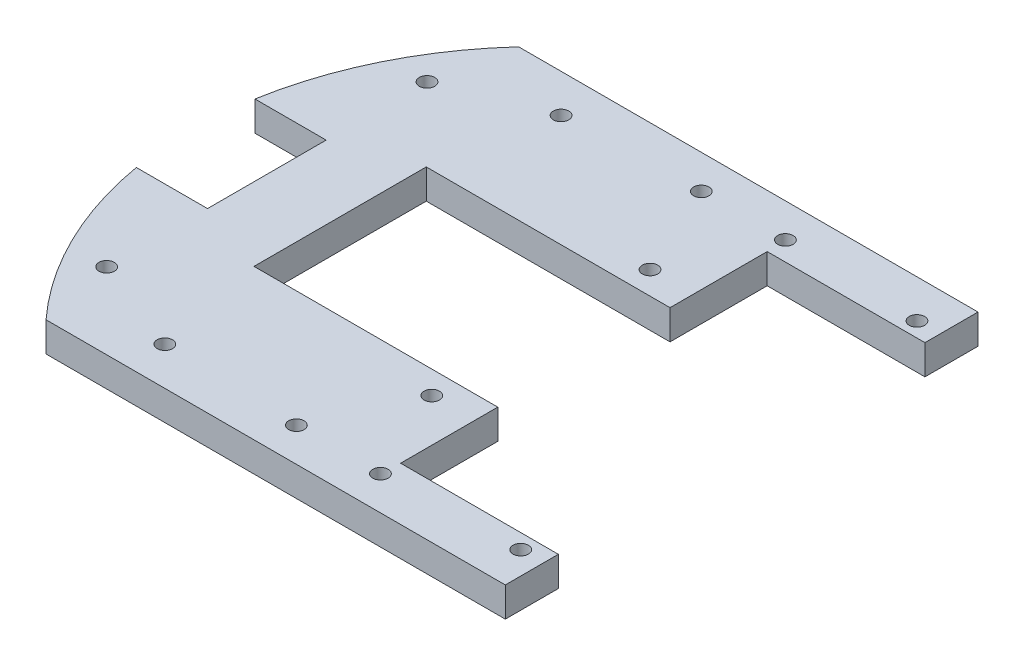
from build123d import *

# Parameters (mm, degrees)
SKETCH1_R           = 1.651
BOSS_EXTRUDE1_DEPTH = 6.35


with BuildPart() as part:
    # Sketch1 → Boss-Extrude1 (new body)
    with BuildSketch(Plane(origin=(0, 0, 0), x_dir=(1, 0, 0), z_dir=(0, 1, 0))):
        with BuildLine():
            Line((33.776652136, 7.168881649), (0, 7.168881649))
            Line((0, 7.168881649), (0, 44.052727236))
            Line((0, 44.052727236), (33.776652136, 44.052727236))
            Line((33.776652136, 44.052727236), (52.191652136, 44.052727236))
            Line((52.191652136, 44.052727236), (52.191652136, 64.853804442))
            Line((52.191652136, 64.853804442), (85.968304273, 64.853804442))
            Line((85.968304273, 64.853804442), (85.968304273, 76.214266248))
            Line((85.968304273, 76.214266248), (0, 76.214266248))
            Line((0, 76.214266248), (-12.371874213, 76.214266248))
            ThreePointArc((-12.371874213, 76.214266248), (-24.373410945, 58.595023332), (-30.932760678, 38.310804442))
            Line((-30.932760678, 38.310804442), (-15.692760678, 38.310804442))
            Line((-15.692760678, 38.310804442), (-15.692760678, 12.910804442))
            Line((-15.692760678, 12.910804442), (-30.932760678, 12.910804442))
            ThreePointArc((-30.932760678, 12.910804442), (-24.373410945, -7.373414447), (-12.371874213, -24.992657364))
            Line((-12.371874213, -24.992657364), (0, -24.992657364))
            Line((0, -24.992657364), (85.968304273, -24.992657364))
            Line((85.968304273, -24.992657364), (85.968304273, -13.632195558))
            Line((85.968304273, -13.632195558), (52.191652136, -13.632195558))
            Line((52.191652136, -13.632195558), (52.191652136, 7.168881649))
            Line((52.191652136, 7.168881649), (33.776652136, 7.168881649))
        make_face()
        with Locations(Location((4.884152136, -16.807195558, 0), (0, 0, 270))):
            Circle(SKETCH1_R, mode=Mode.SUBTRACT)
        with Locations(Location((81.084152136, -16.807195558, 0), (0, 0, 270))):
            Circle(SKETCH1_R, mode=Mode.SUBTRACT)
        with Locations(Location((42.984152136, 2.242804442, 0), (0, 0, 270))):
            Circle(SKETCH1_R, mode=Mode.SUBTRACT)
        with Locations(Location((33.983402136, -17.742657364, 0), (0, 0, 270))):
            Circle(SKETCH1_R, mode=Mode.SUBTRACT)
        with Locations(Location((51.983402136, -17.742657364, 0), (0, 0, 270))):
            Circle(SKETCH1_R, mode=Mode.SUBTRACT)
        with Locations(Location((51.983402136, 68.964266248, 0), (0, 0, 90))):
            Circle(SKETCH1_R, mode=Mode.SUBTRACT)
        with Locations(Location((33.983402136, 68.964266248, 0), (0, 0, 90))):
            Circle(SKETCH1_R, mode=Mode.SUBTRACT)
        with Locations(Location((42.984152136, 48.978804442, 0), (0, 0, 90))):
            Circle(SKETCH1_R, mode=Mode.SUBTRACT)
        with Locations(Location((81.084152136, 68.028804442, 0), (0, 0, 90))):
            Circle(SKETCH1_R, mode=Mode.SUBTRACT)
        with Locations(Location((4.884152136, 68.028804442, 0), (0, 0, 90))):
            Circle(SKETCH1_R, mode=Mode.SUBTRACT)
        with Locations(Location((-15.692760678, 59.900804442, 0), (0, 0, 270))):
            Circle(SKETCH1_R, mode=Mode.SUBTRACT)
        with Locations(Location((-15.692760678, -8.679195558, 0), (0, 0, 270))):
            Circle(SKETCH1_R, mode=Mode.SUBTRACT)
    extrude(amount=BOSS_EXTRUDE1_DEPTH)


solid = part.part
